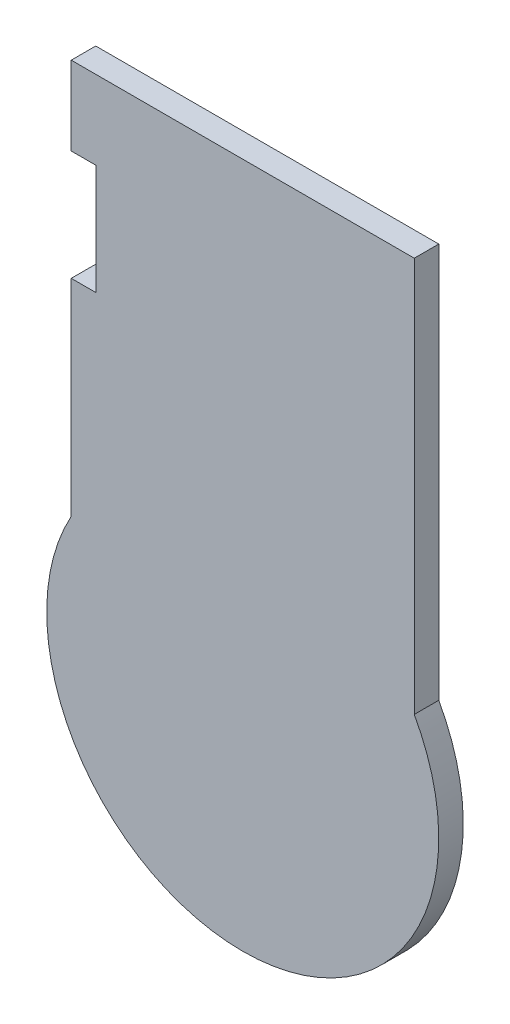
from build123d import *

# Parameters (mm, degrees)
EXTRUDE_1_DEPTH     = 5
SKETCH_2_W          = 12.2
SKETCH_2_H          = 22.5
CUT_EXTRUDE_1_DEPTH = 108.819293264


with BuildPart() as part:
    # ｽｹｯﾁ1 → ﾎﾞｽ - 押し出し1 (new body)
    with BuildSketch(Plane.XY):
        with BuildLine():
            Line((35, 100), (-35, 100))
            Line((-35, 100), (-35, 19.364916731))
            ThreePointArc((-35, 19.364916731), (0, -40), (35, 19.364916731))
            Line((35, 19.364916731), (35, 100))
        make_face()
    extrude(amount=EXTRUDE_1_DEPTH)

    # ｽｹｯﾁ2 → ｶｯﾄ - 押し出し1 (cut, through all)
    with BuildSketch(Plane.XY.offset(5)):
        with Locations((-36, 72.689802684)):
            Rectangle(SKETCH_2_W, SKETCH_2_H)
    extrude(amount=-CUT_EXTRUDE_1_DEPTH, mode=Mode.SUBTRACT)


solid = part.part
